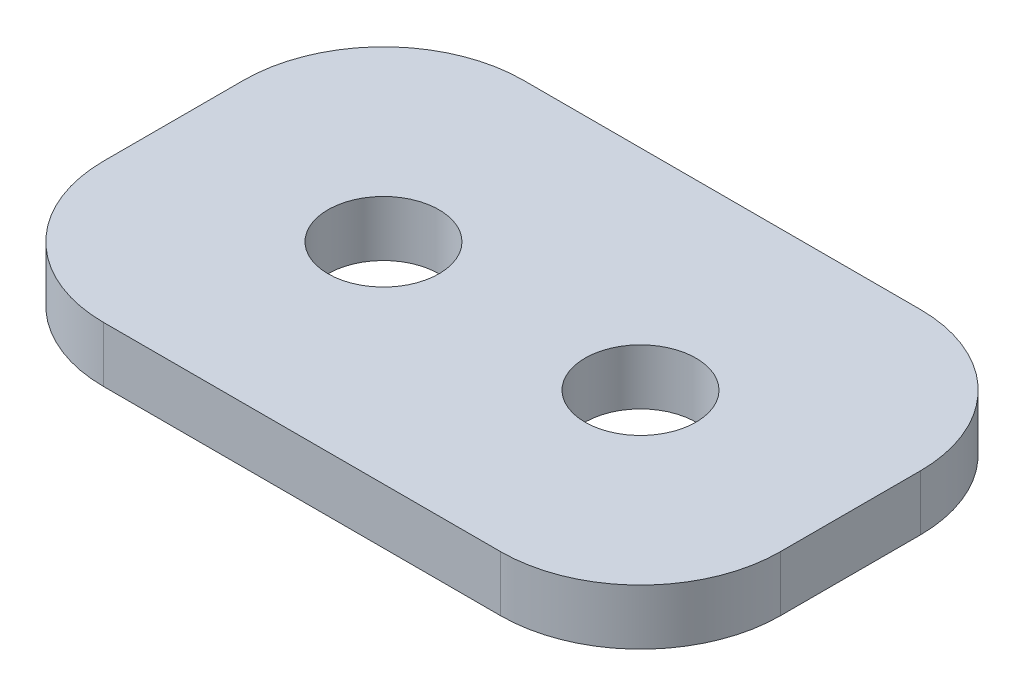
from build123d import *

# Parameters (mm, degrees)
SKETCH1_W           = 19.35
SKETCH1_H           = 12
SKETCH1_R           = 1.5875
BOSS_EXTRUDE1_DEPTH = 0.79375
FILLET1_R           = 4


with BuildPart() as part:
    # Sketch1 → Boss-Extrude1 (new, symmetric)
    with BuildSketch(Plane(origin=(0, 0, 0), x_dir=(1, 0, 0), z_dir=(0, 1, 0))):
        Rectangle(SKETCH1_W, SKETCH1_H)
        with Locations(Location((-3.675, 0, 0), (0, 0, 270))):
            Circle(SKETCH1_R, mode=Mode.SUBTRACT)
        with Locations(Location((3.675, 0, 0), (0, 0, 270))):
            Circle(SKETCH1_R, mode=Mode.SUBTRACT)
    extrude(amount=BOSS_EXTRUDE1_DEPTH, both=True)

    # Fillet1
    fillet1_edges = [part.edges().sort_by_distance(p)[0] for p in [
        (-9.675, 0, -6),
        (9.675, 0, -6),
        (9.675, 0, 6),
        (-9.675, 0, 6),
    ]]
    fillet(fillet1_edges, radius=FILLET1_R)


solid = part.part
